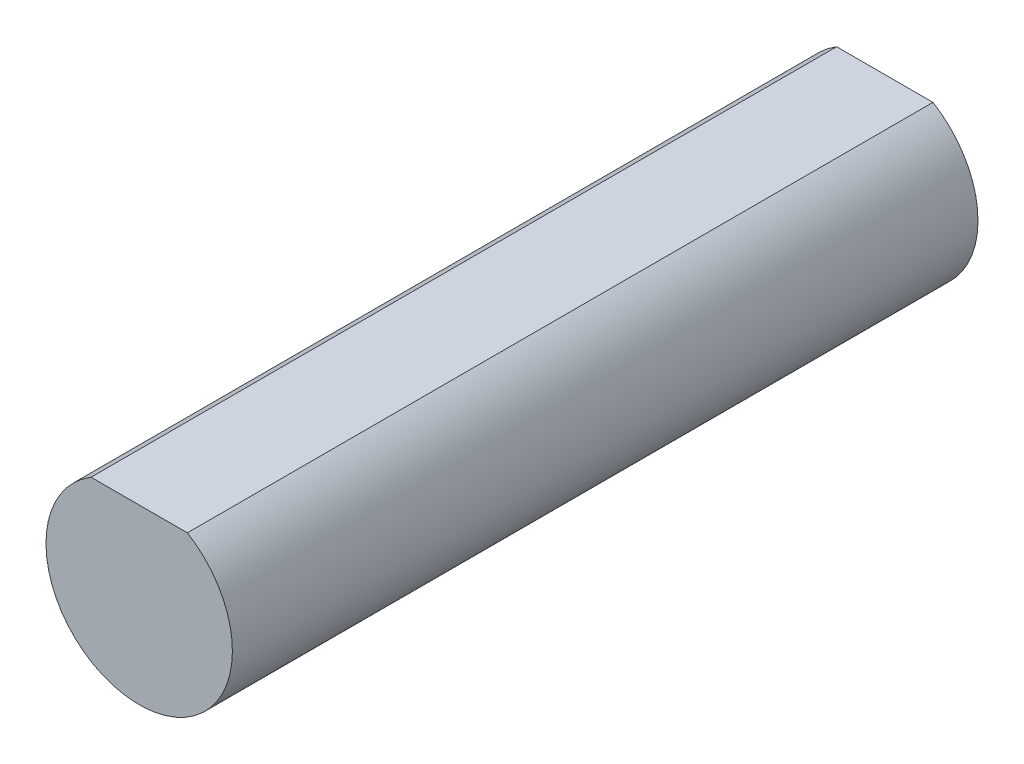
from build123d import *

# Parameters (mm, degrees)
SKETCH1_R           = 3.175
BOSS_EXTRUDE1_DEPTH = 25.4
CUT_EXTRUDE1_DEPTH  = 26.793821935


with BuildPart() as part:
    # Sketch1 → Boss-Extrude1 (new body)
    with BuildSketch(Plane.XY):
        Circle(SKETCH1_R)
    extrude(amount=BOSS_EXTRUDE1_DEPTH)

    # Sketch2 → Cut-Extrude1 (cut, through all)
    with BuildSketch(Plane(origin=(0, 0, 0), x_dir=(-1, 0, 0), z_dir=(0, 0, -1))):
        with BuildLine():
            Line((-1.641398233, 2.7178), (1.641398233, 2.7178))
            ThreePointArc((1.641398233, 2.7178), (0, 3.175), (-1.641398233, 2.7178))
        make_face()
    extrude(amount=-CUT_EXTRUDE1_DEPTH, mode=Mode.SUBTRACT)


solid = part.part
